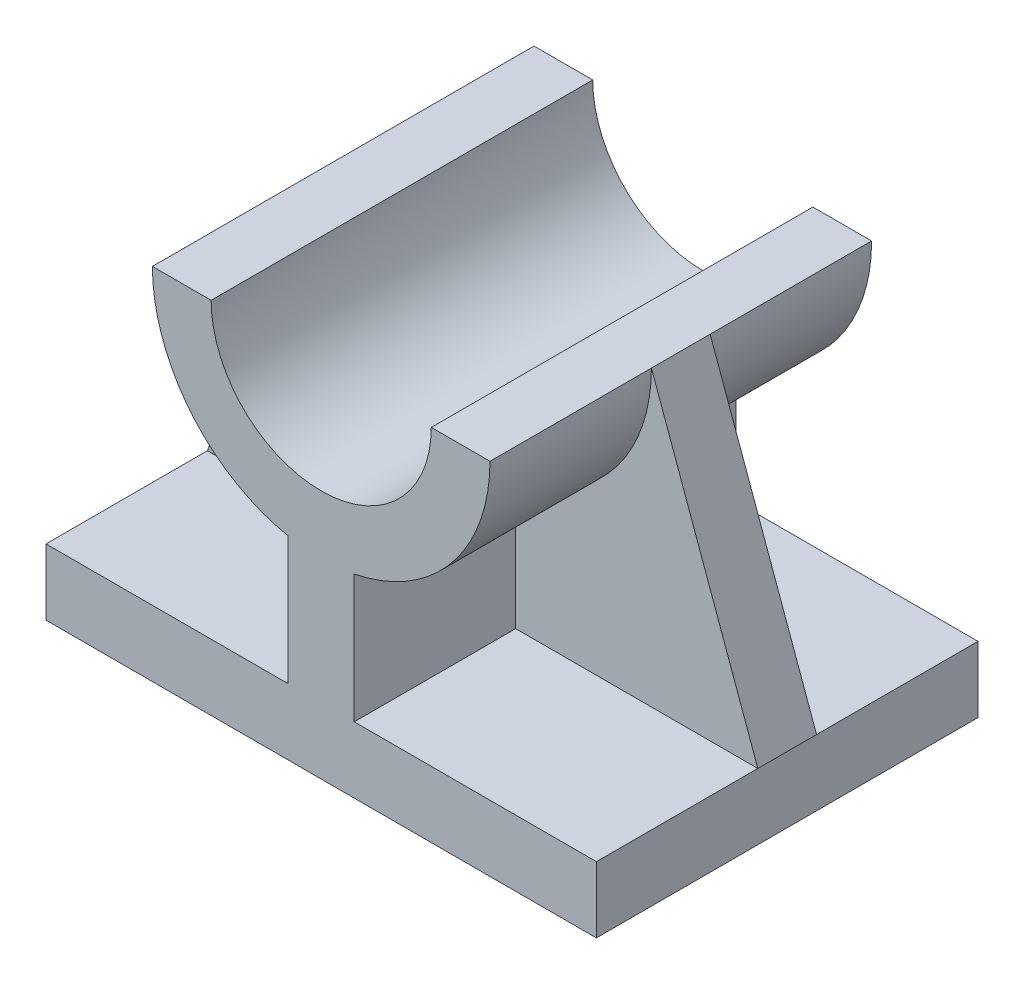
from build123d import *

# Parameters (mm, degrees)
BOSS_EXTRUDE1_DEPTH = 52
RIB1_REACH          = 96.851
SKETCH4_WALLS_W     = 8
SKETCH4_WALLS_H     = 234.248497915
RIB2_REACH          = 101.16
SKETCH5_WALLS_W     = 8
SKETCH5_WALLS_H     = 242.866865728


with BuildPart() as part:
    # Sketch2 → Boss-Extrude1 (new body)
    with BuildSketch(Plane.XY):
        with BuildLine():
            Line((-27.07826087, 9), (-27.07826087, 0))
            Line((-27.07826087, 0), (47.92173913, 0))
            Line((47.92173913, 0), (47.92173913, 9))
            Line((47.92173913, 9), (14.92173913, 9))
            Line((14.92173913, 9), (14.92173913, 26.444512863))
            ThreePointArc((14.92173913, 26.444512863), (28.205158374, 34.414047854), (33.42173913, 49))
            Line((33.42173913, 49), (25.42173913, 49))
            ThreePointArc((25.42173913, 49), (10.42173913, 34), (-4.57826087, 49))
            Line((-4.57826087, 49), (-12.57826087, 49))
            ThreePointArc((-12.57826087, 49), (-7.361680113, 34.414047854), (5.92173913, 26.444512863))
            Line((5.92173913, 26.444512863), (5.92173913, 9))
            Line((5.92173913, 9), (-27.07826087, 9))
        make_face()
    extrude(amount=BOSS_EXTRUDE1_DEPTH)

    # Sketch4 walls → Rib1 (add, up to next)
    with BuildSketch(Plane(origin=(45.2394877, 16.399314291, 0), x_dir=(0, 0, 1), z_dir=(-0.9401360651624828, -0.3407993236214001, 0)), mode=Mode.PRIVATE) as rib1_sk1:
        with Locations((26, 13.403044704)):
            Rectangle(SKETCH4_WALLS_W, SKETCH4_WALLS_H)
    rib1_tool1 = extrude(rib1_sk1.sketch, amount=RIB1_REACH, mode=Mode.PRIVATE) - part.part
    add(rib1_tool1.solids().sort_by_distance((40.67173913, 29, 26))[0])

    # Sketch5 walls → Rib2 (add, up to next)
    with BuildSketch(Plane(origin=(-26.816858109, 9.721111064, 0), x_dir=(0, 0, 1), z_dir=(-0.9401360651624829, 0.34079932362140014, 0)), mode=Mode.PRIVATE) as rib2_sk1:
        with Locations((26, 20.506487997)):
            Rectangle(SKETCH5_WALLS_W, SKETCH5_WALLS_H)
    rib2_tool1 = extrude(rib2_sk1.sketch, amount=-RIB2_REACH, mode=Mode.PRIVATE) - part.part
    add(rib2_tool1.solids().sort_by_distance((-19.82826087, 29, 26))[0])


solid = part.part
